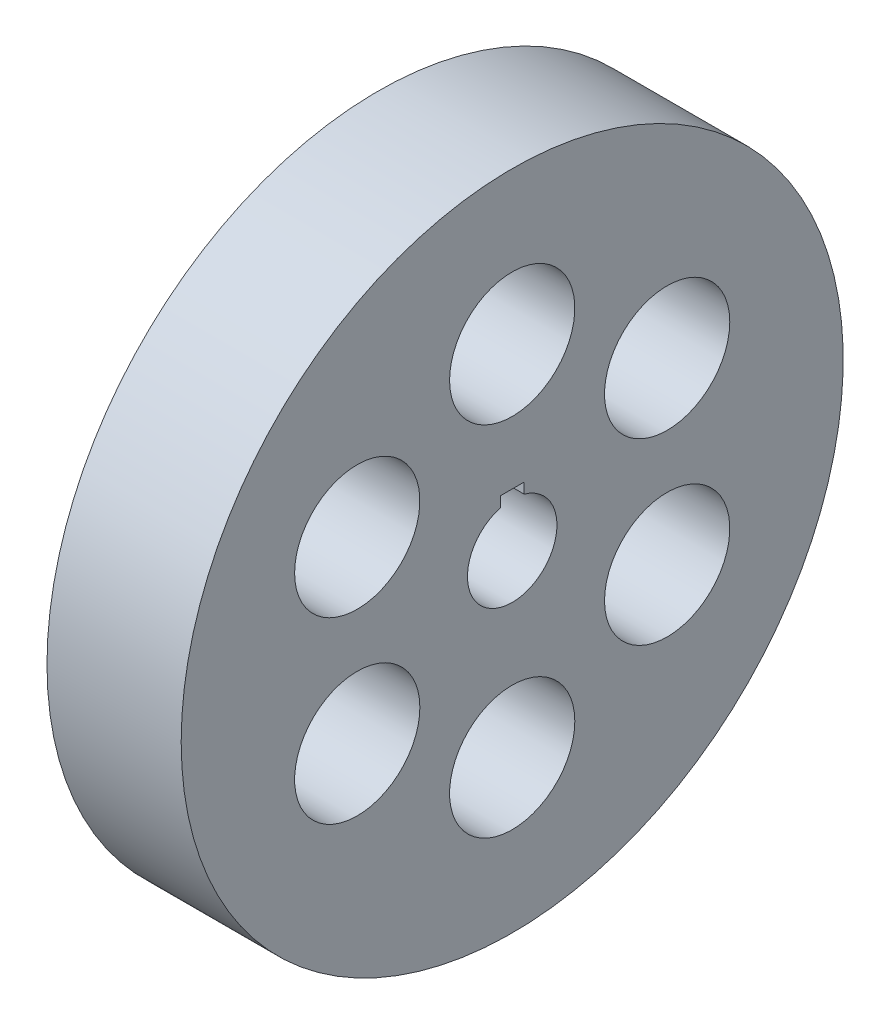
from build123d import *

# Parameters (mm, degrees)
CUT_EXTRUDE1_DEPTH  = 172.877863613
SKETCH4_R           = 21
CUT_EXTRUDE3_DEPTH  = 161.832210704
SKETCH5_W           = 8
SKETCH5_H           = 3.5
BOSS_EXTRUDE1_DEPTH = 70
SKETCH6_R           = 15
CUT_EXTRUDE4_DEPTH  = 172.877863613
SKETCH7_W           = 8
SKETCH7_H           = 7
CUT_EXTRUDE5_DEPTH  = 172.877863613
SKETCH8_W           = 8
SKETCH8_H           = 0.543167705
BOSS_EXTRUDE2_DEPTH = 70


with BuildPart() as part:
    # Sketch1 → Revolve1 (revolve)
    with BuildSketch(Plane(origin=(0, 0, 0), x_dir=(1, 0, 0), z_dir=(0, 1, 0)), mode=Mode.PRIVATE) as revolve1_sk:
        with BuildLine():
            Line((0, 0), (0, 30))
            Line((0, 30), (35, 30))
            Line((35, 30), (35, 91))
            ThreePointArc((35, 91), (33.535533906, 94.535533906), (30, 96))
            Line((30, 96), (25, 96))
            Line((25, 96), (25, 111))
            Line((25, 111), (70, 111))
            Line((70, 111), (70, 0))
            Line((70, 0), (0, 0))
        make_face()
    revolve(revolve1_sk.sketch.rotate(Axis((-137.76, 0, 0), (1, 0, 0)), 180), axis=Axis((-137.76, 0, 0), (1, 0, 0)))

    # Sketch2 → Cut-Extrude1 (cut, through all)
    with BuildSketch(Plane.ZY):
        with BuildLine():
            Line((-4, 10.494049493), (-4, 17.494049493))
            Line((-4, 17.494049493), (4, 17.494049493))
            Line((4, 17.494049493), (4, 10.494049493))
            ThreePointArc((4, 10.494049493), (0, -11.230542051), (-4, 10.494049493))
        make_face()
    extrude(amount=-CUT_EXTRUDE1_DEPTH, mode=Mode.SUBTRACT)

    # Sketch4 → Cut-Extrude3 (cut, through all)
    with BuildSketch(Plane.ZY.offset(-35)):
        with Locations((0, 60)):
            Circle(SKETCH4_R)
        with Locations((51.961524227, 30)):
            Circle(SKETCH4_R)
        with Locations(Location((-51.961524227, 30, 0), (0, 0, 180))):
            Circle(SKETCH4_R)
        with Locations(Location((51.961524227, -30, 0), (0, 0, 180))):
            Circle(SKETCH4_R)
        with Locations(Location((0, -60, 0), (0, 0, 180))):
            Circle(SKETCH4_R)
        with Locations((-51.961524227, -30)):
            Circle(SKETCH4_R)
    extrude(amount=-CUT_EXTRUDE3_DEPTH, mode=Mode.SUBTRACT)

    # Sketch5 → Boss-Extrude1 (add)
    with BuildSketch(Plane.ZY):
        with Locations((0, 15.744049493)):
            Rectangle(SKETCH5_W, SKETCH5_H)
    extrude(amount=-BOSS_EXTRUDE1_DEPTH)

    # Sketch6 → Cut-Extrude4 (cut, through all)
    with BuildSketch(Plane.ZY):
        Circle(SKETCH6_R)
    extrude(amount=-CUT_EXTRUDE4_DEPTH, mode=Mode.SUBTRACT)

    # Sketch7 → Cut-Extrude5 (cut, through all)
    with BuildSketch(Plane.ZY):
        with Locations((0, 15)):
            Rectangle(SKETCH7_W, SKETCH7_H)
    extrude(amount=-CUT_EXTRUDE5_DEPTH, mode=Mode.SUBTRACT)

    # Sketch8 → Boss-Extrude2 (add)
    with BuildSketch(Plane.ZY):
        with Locations((0, 18.228416147)):
            Rectangle(SKETCH8_W, SKETCH8_H)
    extrude(amount=-BOSS_EXTRUDE2_DEPTH)


solid = part.part
